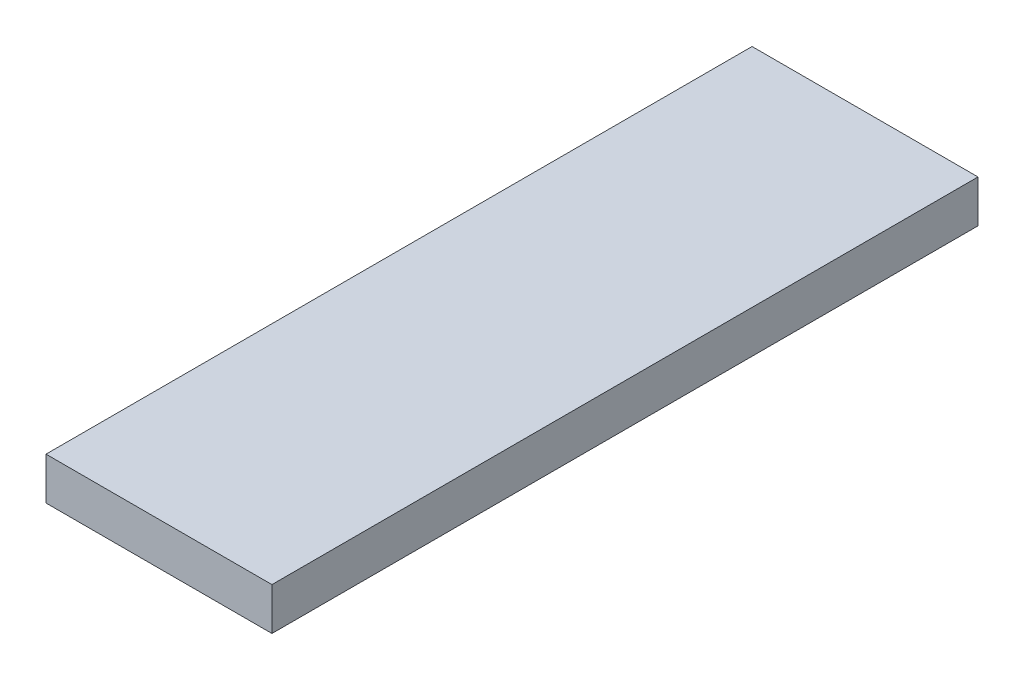
from build123d import *

# Parameters (mm, degrees)
SKETCH1_W           = 16
SKETCH1_H           = 50
BOSS_EXTRUDE1_DEPTH = 3


with BuildPart() as part:
    # Sketch1 → Boss-Extrude1 (new body)
    with BuildSketch(Plane(origin=(0, 0, 0), x_dir=(1, 0, 0), z_dir=(0, 1, 0))):
        Rectangle(SKETCH1_W, SKETCH1_H)
    extrude(amount=BOSS_EXTRUDE1_DEPTH)


solid = part.part
